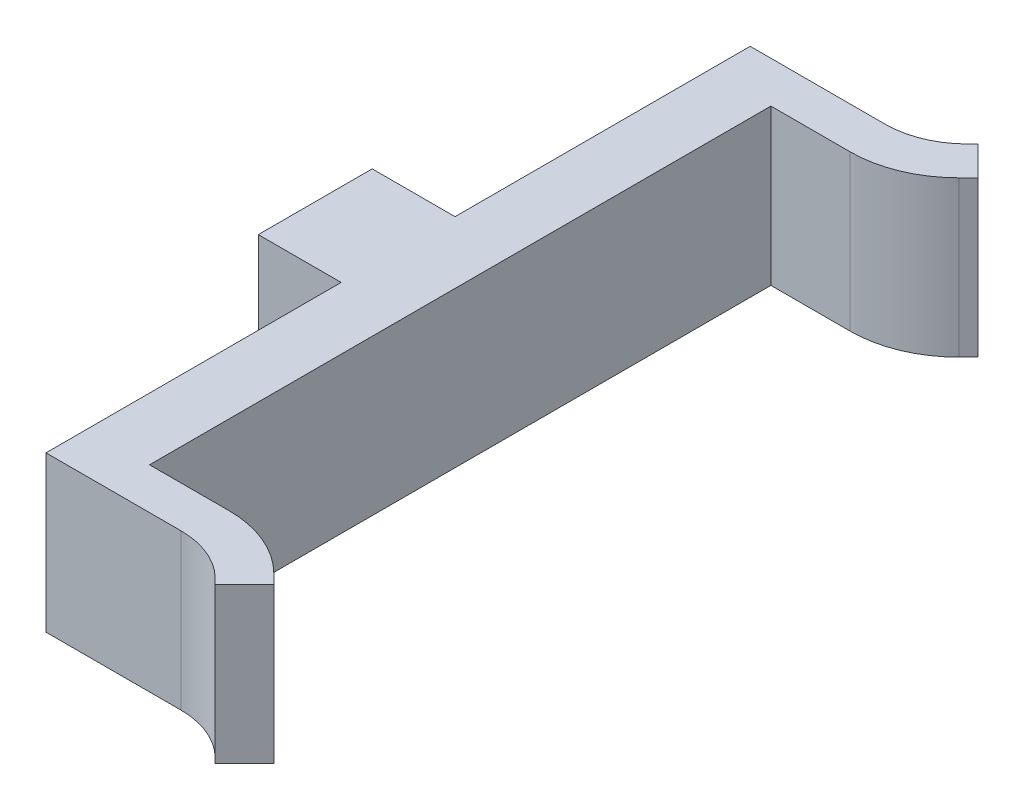
from build123d import *

# Parameters (mm, degrees)
BOSS_EXTRUDE2_DEPTH = 15
BOSS_EXTRUDE3_DEPTH = 8
CUT_EXTRUDE3_DEPTH  = 8
FILLET1_R           = 0.3
SKETCH5_W           = 8
SKETCH5_H           = 11
BOSS_EXTRUDE4_DEPTH = 3
SKETCH6_W           = 8
SKETCH6_H           = 11
BOSS_EXTRUDE5_DEPTH = 3


with BuildPart() as part:
    # Sketch1 → Boss-Extrude2 (new body)
    with BuildSketch(Plane(origin=(0, 0, 0), x_dir=(1, 0, 0), z_dir=(0, 1, 0))):
        with BuildLine():
            Line((0, 34), (0, 0))
            Line((0, 0), (6, 0))
            Line((6, 0), (6, 30))
            Line((6, 30), (13.650757595, 30))
            ThreePointArc((13.650757595, 30), (17.668933635, 30.799264909), (21.075378798, 33.075378798))
            Line((21.075378798, 33.075378798), (22, 34))
            Line((22, 34), (19.171572875, 36.828427125))
            Line((19.171572875, 36.828427125), (18.686291501, 36.343145751))
            ThreePointArc((18.686291501, 36.343145751), (16.09090471, 34.60896374), (13.029437252, 34))
            Line((13.029437252, 34), (0, 34))
        make_face()
        with BuildLine():
            Line((0, 0), (0, -34))
            Line((0, -34), (13.029437252, -34))
            ThreePointArc((13.029437252, -34), (16.09090471, -34.60896374), (18.686291501, -36.343145751))
            Line((18.686291501, -36.343145751), (19.171572875, -36.828427125))
            Line((19.171572875, -36.828427125), (22, -34))
            Line((22, -34), (21.075378798, -33.075378798))
            ThreePointArc((21.075378798, -33.075378798), (17.668933635, -30.799264909), (13.650757595, -30))
            Line((13.650757595, -30), (6, -30))
            Line((6, -30), (6, 0))
            Line((6, 0), (0, 0))
        make_face()
    extrude(amount=BOSS_EXTRUDE2_DEPTH)

    # Sketch3 → Boss-Extrude3 (add)
    with BuildSketch(Plane.ZY):
        Polygon((0, 7.5), (-5.5, 6.286764706), (-5.5, 3), (5.5, 3), (5.5, 6.286764706), align=None)
        Polygon((-5.5, 8.713235294), (0, 7.5), (5.5, 8.713235294), (5.5, 12), (-5.5, 12), align=None)
        Polygon((-5.5, 8.713235294), (-5.5, 6.286764706), (0, 7.5), align=None)
        Polygon((5.5, 8.713235294), (0, 7.5), (5.5, 6.286764706), align=None)
    extrude(amount=BOSS_EXTRUDE3_DEPTH)

    # Sketch4 → Cut-Extrude3 (cut)
    with BuildSketch(Plane.ZY.offset(8)):
        with BuildLine():
            Line((-1.929617446, 9.797079997), (-1.929617446, 5.202920003))
            ThreePointArc((-1.929617446, 5.202920003), (0, 4.5), (1.929617446, 5.202920003))
            Line((1.929617446, 5.202920003), (1.929617446, 9.797079997))
            ThreePointArc((1.929617446, 9.797079997), (0, 10.5), (-1.929617446, 9.797079997))
        make_face()
    extrude(amount=-CUT_EXTRUDE3_DEPTH, mode=Mode.SUBTRACT)

    # Fillet1
    fillet1_edges = [part.edges().sort_by_distance(p)[0] for p in [
        (-8, 7.5, 1.929617446),
        (-8, 10.5, 0),
        (-8, 7.5, -1.929617446),
        (-8, 4.5, 0),
    ]]
    fillet(fillet1_edges, radius=FILLET1_R)

    # Sketch5 → Boss-Extrude4 (add)
    with BuildSketch(Plane.XZ.offset(-3)):
        with Locations((-4, 0)):
            Rectangle(SKETCH5_W, SKETCH5_H)
    extrude(amount=BOSS_EXTRUDE4_DEPTH)

    # Sketch6 → Boss-Extrude5 (add)
    with BuildSketch(Plane(origin=(0, 12, 0), x_dir=(1, 0, 0), z_dir=(0, 1, 0))):
        with Locations((-4, 0)):
            Rectangle(SKETCH6_W, SKETCH6_H)
    extrude(amount=BOSS_EXTRUDE5_DEPTH)


solid = part.part
